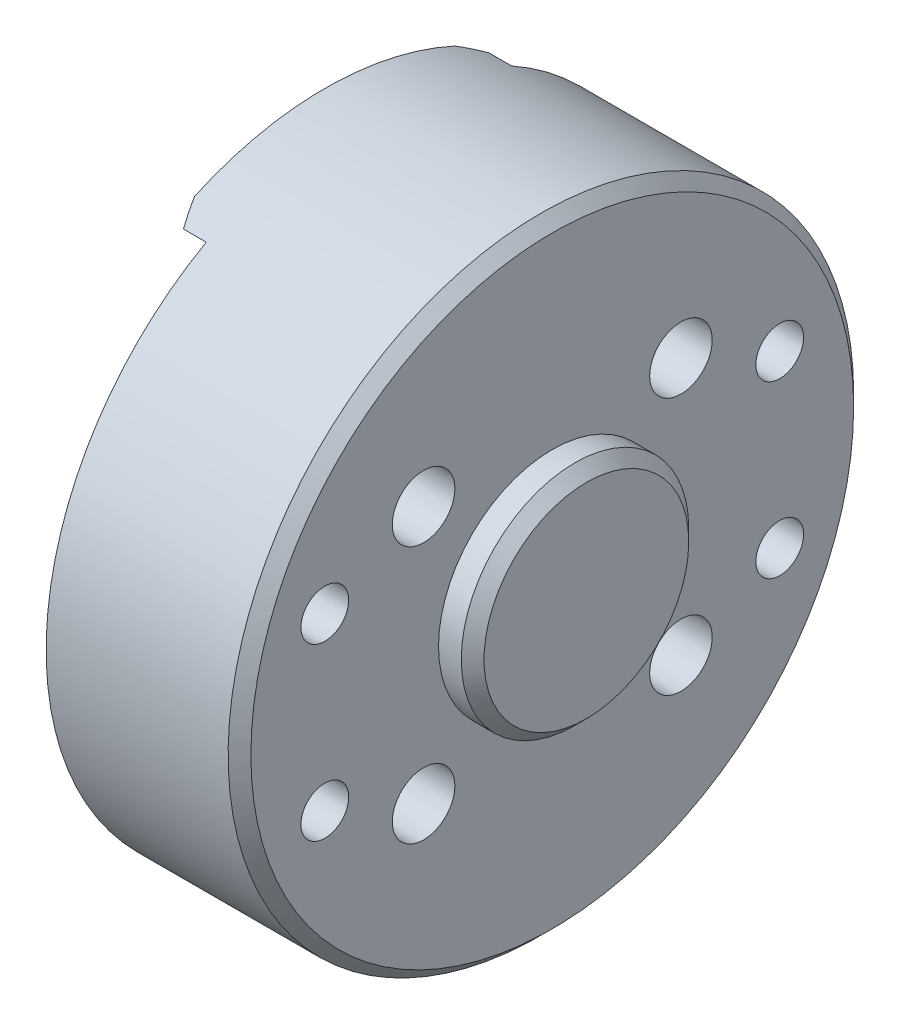
from build123d import *

# Parameters (mm, degrees)
SKETCH_1_R               = 27.5
EXTRUDE_1_DEPTH          = 10
SKETCH_2_R               = 10
EXTRUDE_2_DEPTH          = 3
SKETCH_3_R               = 2.75
CUT_EXTRUDE_1_DEPTH      = 30
PATTERN_CIRCULAR_1_COUNT = 4
SKETCH_4_R               = 5
CUT_EXTRUDE_2_DEPTH      = 10
PATTERN_CIRCULAR_2_COUNT = 4
SKETCH_5_W               = 66.473755295
SKETCH_5_H               = 48
CUT_EXTRUDE_3_DEPTH      = 3
CHAMFER_1_SIZE           = 1
CHAMFER_2_SIZE           = 1


with BuildPart() as part:
    # 草图1 → 凸台-拉伸1 (new, symmetric)
    with BuildSketch(Plane(origin=(0, 0, 0), x_dir=(0, 0, -1), z_dir=(1, 0, 0))):
        Circle(SKETCH_1_R)
    extrude(amount=EXTRUDE_1_DEPTH, both=True)

    # 草图2 → 凸台-拉伸2 (add)
    with BuildSketch(Plane(origin=(10, 0, 0), x_dir=(0, 0, -1), z_dir=(1, 0, 0))):
        Circle(SKETCH_2_R)
    extrude(amount=EXTRUDE_2_DEPTH)

    # 草图3 → 切除-拉伸1 (cut)
    with BuildSketch(Plane.ZY.offset(10)):
        with Locations((11.313708499, 11.313708499)):
            Circle(SKETCH_3_R)
    cut_extrude_1 = extrude(amount=-CUT_EXTRUDE_1_DEPTH, mode=Mode.SUBTRACT)

    # 阵列(圆周)1: 切除-拉伸1 ×4 about axis
    pattern_circular_1_axis = Axis((0, 0, 0), (1, 0, 0))
    for i in range(1, PATTERN_CIRCULAR_1_COUNT):
        add(cut_extrude_1.rotate(pattern_circular_1_axis, i * 360 / PATTERN_CIRCULAR_1_COUNT), mode=Mode.SUBTRACT)

    # 草图4 → 切除-拉伸2 (cut)
    with BuildSketch(Plane.ZY.offset(10)):
        with Locations((-11.313708499, 11.313708499)):
            Circle(SKETCH_4_R)
    cut_extrude_2 = extrude(amount=-CUT_EXTRUDE_2_DEPTH, mode=Mode.SUBTRACT)

    # 阵列(圆周)2: 切除-拉伸2 ×4 about axis
    pattern_circular_2_axis = Axis((0, 0, 0), (1, 0, 0))
    for i in range(1, PATTERN_CIRCULAR_2_COUNT):
        add(cut_extrude_2.rotate(pattern_circular_2_axis, i * 360 / PATTERN_CIRCULAR_2_COUNT), mode=Mode.SUBTRACT)

    # 草图5 → 切除-拉伸3 (cut)
    with BuildSketch(Plane.ZY.offset(10)):
        with Locations((4.248104101, 0)):
            Rectangle(SKETCH_5_W, SKETCH_5_H)
    extrude(amount=-CUT_EXTRUDE_3_DEPTH, mode=Mode.SUBTRACT)

    # 倒角1
    chamfer_1_edges = [part.edges().sort_by_distance(p)[0] for p in [
        (-10, 24, 0),
        (-10, -24, 0),
    ]]
    chamfer(chamfer_1_edges, length=CHAMFER_1_SIZE)

    # 倒角2
    chamfer_2_edges = [part.edges().sort_by_distance(p)[0] for p in [
        (10, 0, 27.5),
        (13, 0, 10),
    ]]
    chamfer(chamfer_2_edges, length=CHAMFER_2_SIZE)

    # 草图6 → M5 螺纹孔1 (revolve, cut)
    with BuildSketch(Plane(origin=(-7, -7.5, -20), x_dir=(0, 0, 1), z_dir=(0, 1, 0))):
        Polygon((0, 0), (0, 33.6618073), (2.1, 32.4), (2.1, 0), align=None)
    hole_wizard_m5_1 = revolve(axis=Axis((-13.35, -7.5, -20), (1, 0, 0)), mode=Mode.SUBTRACT)

    # 镜向1: M5 螺纹孔1 across plane
    add(hole_wizard_m5_1.mirror(Plane.ZX), mode=Mode.SUBTRACT)

    # 镜向2: M5 螺纹孔1 across plane
    add(hole_wizard_m5_1.mirror(Plane.XY), mode=Mode.SUBTRACT)

    # 镜向2 copy 1 sketch → 镜向2 copy 1 (revolve, cut)
    with BuildSketch(Plane(origin=(-7, 7.5, 20), x_dir=(0, 0, -1), z_dir=(0, -1, 0))):
        Polygon((0, 0), (0, 33.6618073), (2.1, 32.4), (2.1, 0), align=None)
    revolve(axis=Axis((-13.35, 7.5, 20), (1, 0, 0)), mode=Mode.SUBTRACT)


solid = part.part
